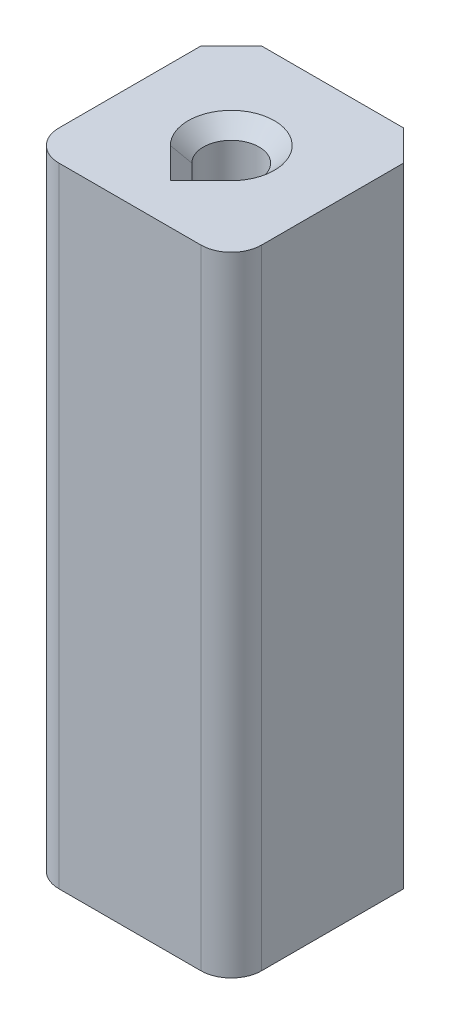
from build123d import *

# Parameters (mm, degrees)
BOSS_EXTRUDE1_DEPTH      = 10
BOSS_EXTRUDE1_DEPTH_BACK = 10
SKETCH3_W                = 20
SKETCH3_H                = 62
FILLET1_R                = 3
CUT_EXTRUDE1_DEPTH       = 64.592452382
CHAMFER1_SIZE            = 1.5
CHAMFER2_SIZE            = 3


with BuildPart() as part:
    # Sketch3 → Boss-Extrude1 (new, two sides: drawn at the far end of the back side and taken through both)
    with BuildSketch(Plane(origin=(0, 0, 0), x_dir=(0, 0, -1), z_dir=(1, 0, 0)).offset(-BOSS_EXTRUDE1_DEPTH_BACK)):
        with Locations((0, 31)):
            Rectangle(SKETCH3_W, SKETCH3_H)
    extrude(amount=BOSS_EXTRUDE1_DEPTH + BOSS_EXTRUDE1_DEPTH_BACK)

    # Fillet1
    fillet1_edges = [part.edges().sort_by_distance(p)[0] for p in [
        (-10, 31, 10),
        (10, 31, 10),
    ]]
    fillet(fillet1_edges, radius=FILLET1_R)

    # Sketch4 → Cut-Extrude1 (cut, through all)
    with BuildSketch(Plane(origin=(0, 62, 0), x_dir=(1, 0, 0), z_dir=(0, 1, 0))):
        with BuildLine():
            Line((0, -3.889087297), (1.944543648, -1.944543648))
            ThreePointArc((1.944543648, -1.944543648), (0, 2.75), (-1.944543648, -1.944543648))
            Line((-1.944543648, -1.944543648), (0, -3.889087297))
        make_face()
    extrude(amount=-CUT_EXTRUDE1_DEPTH, mode=Mode.SUBTRACT)

    # Chamfer1
    chamfer1_edges = [part.edges().sort_by_distance(p)[0] for p in [
        (0.972271824, 62, 2.916815472),
        (-0.972271824, 62, 2.916815472),
        (0, 62, -2.75),
    ]]
    chamfer(chamfer1_edges, length=CHAMFER1_SIZE)

    # Chamfer2
    chamfer2_edges = [part.edges().sort_by_distance(p)[0] for p in [
        (-10, 31, -10),
        (10, 31, -10),
    ]]
    chamfer(chamfer2_edges, length=CHAMFER2_SIZE)


solid = part.part
